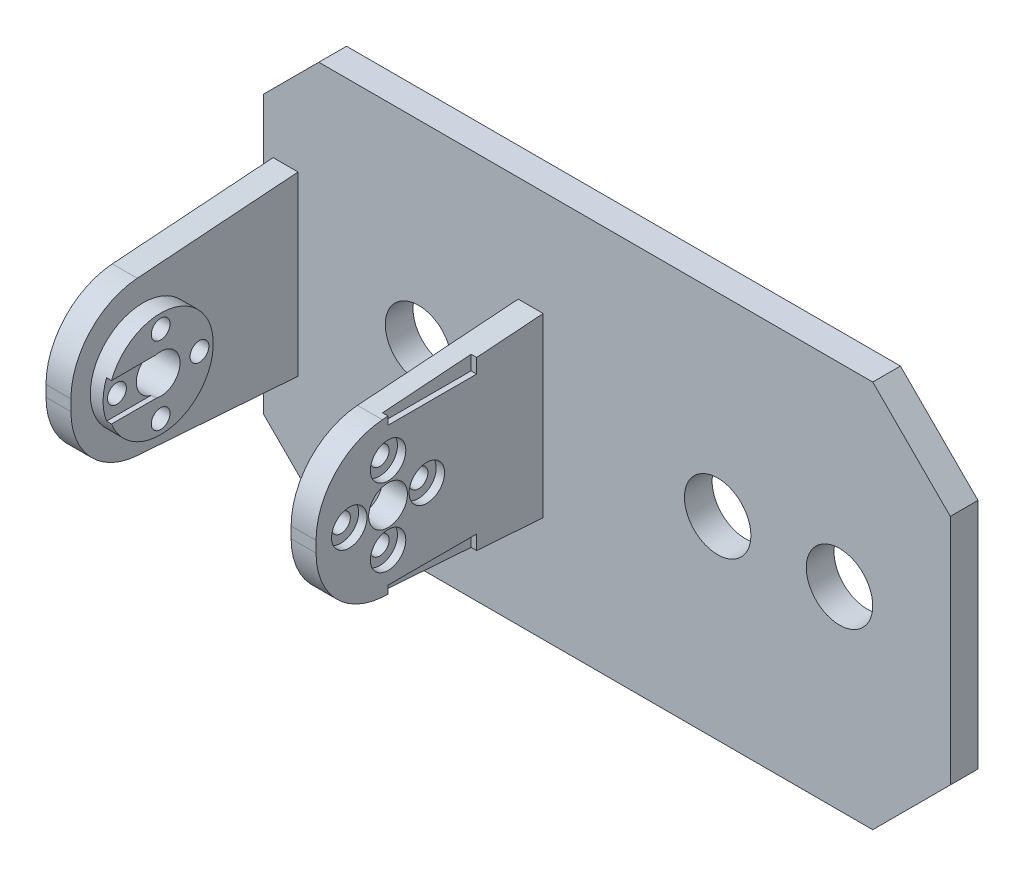
from build123d import *

# Parameters (mm, degrees)
BOSS_1_DEPTH    = 5
BOSS_2_DEPTH    = 4.5
S_CYL3_R        = 9.5
BOSS_3_DEPTH    = 3.2
BOSS_4_DEPTH    = 4.5
S_HOLE5_R       = 3.5
HOLE_5_DEPTH    = 4.7
S_HOLE6_R       = 1.7
HOLE_6_DEPTH    = 4.7
S_HOLE7_R       = 1.7
HOLE_7_DEPTH    = 4.7
S_HOLE8_R       = 1.7
HOLE_8_DEPTH    = 4.7
S_HOLE9_R       = 1.7
HOLE_9_DEPTH    = 4.7
S_HOLE10_R      = 3.2
HOLE_10_DEPTH   = 1.6
S_HOLE11_R      = 3.2
HOLE_11_DEPTH   = 1.6
S_HOLE12_R      = 3.2
HOLE_12_DEPTH   = 1.6
S_HOLE13_R      = 3.2
HOLE_13_DEPTH   = 1.6
S_HOLE14_R      = 3.5
HOLE_14_DEPTH   = 7.9
S_HOLE15_R      = 1.7
HOLE_15_DEPTH   = 7.9
S_HOLE16_R      = 1.7
HOLE_16_DEPTH   = 7.9
S_HOLE17_R      = 1.7
HOLE_17_DEPTH   = 7.9
S_HOLE18_R      = 1.7
HOLE_18_DEPTH   = 7.9
S_HOLE19_R      = 3.2
HOLE_19_DEPTH   = 2.1
S_HOLE20_R      = 3.2
HOLE_20_DEPTH   = 2.1
S_HOLE21_R      = 3.2
HOLE_21_DEPTH   = 2.1
S_HOLE22_R      = 3.2
HOLE_22_DEPTH   = 2.1
S_CUT23_W       = 1
S_CUT23_H       = 6.8
POCKET_23_DEPTH = 10
S_HOLE24_R      = 6
HOLE_24_DEPTH   = 5.2
S_HOLE25_R      = 6
HOLE_25_DEPTH   = 5.2
S_HOLE26_R      = 6
HOLE_26_DEPTH   = 5.2
S_CUT27_W       = 1.1
S_CUT27_H       = 4.5
POCKET_27_DEPTH = 16
S_CUT28_W       = 1.1
S_CUT28_H       = 4.5
POCKET_28_DEPTH = 16


with BuildPart() as part:
    # S_prism1 → Boss_1 (new body)
    with BuildSketch(Plane.XY.offset(-33)):
        Polygon((56, -21), (56, 21), (42, 35), (-58, 35), (-68, 25), (-68, -25), (-58, -35), (42, -35), align=None)
    extrude(amount=BOSS_1_DEPTH)

    # S_prism2 → Boss_2 (add)
    with BuildSketch(Plane(origin=(-22, 0, 0), x_dir=(0, 0, -1), z_dir=(1, 0, 0))):
        with BuildLine():
            Line((28.5, -16), (28.5, 16))
            Line((28.5, 16), (-1.0301, 13.8653))
            ThreePointArc((-1.0301, 13.8653), (-9.544808445, 9.785590923), (-13, 0.9989))
            Line((-13, 0.9989), (-13, -0.9989))
            ThreePointArc((-13, -0.9989), (-9.544808445, -9.785590923), (-1.0301, -13.8653))
            Line((-1.0301, -13.8653), (28.5, -16))
        make_face()
    extrude(amount=BOSS_2_DEPTH)



with BuildPart() as body_2:
    # S_cyl3 → Boss_3 (new body)
    with BuildSketch(Plane(origin=(-61.75, 0, 0), x_dir=(0, 0, -1), z_dir=(1, 0, 0))):
        Circle(S_CYL3_R)
    extrude(amount=BOSS_3_DEPTH)


with BuildPart() as part_1:
    add(part.part)

    add(body_2.part)  # Boss_4 merges body 2
    # S_prism4 → Boss_4 (add)
    with BuildSketch(Plane(origin=(-66.25, 0, 0), x_dir=(0, 0, -1), z_dir=(1, 0, 0))):
        with BuildLine():
            Line((28.5, -16), (28.5, 16))
            Line((28.5, 16), (-1.0301, 13.8653))
            ThreePointArc((-1.0301, 13.8653), (-9.544808445, 9.785590923), (-13, 0.9989))
            Line((-13, 0.9989), (-13, -0.9989))
            ThreePointArc((-13, -0.9989), (-9.544808445, -9.785590923), (-1.0301, -13.8653))
            Line((-1.0301, -13.8653), (28.5, -16))
        make_face()
    extrude(amount=BOSS_4_DEPTH)

    # S_hole5 → Hole_5 (cut)
    with BuildSketch(Plane(origin=(-22.1, 0, 0), x_dir=(0, 0, -1), z_dir=(1, 0, 0))):
        Circle(S_HOLE5_R)
    extrude(amount=HOLE_5_DEPTH, mode=Mode.SUBTRACT)

    # S_hole6 → Hole_6 (cut)
    with BuildSketch(Plane(origin=(-22.1, 0, 0), x_dir=(0, 0, -1), z_dir=(1, 0, 0))):
        with Locations((0, 7)):
            Circle(S_HOLE6_R)
    extrude(amount=HOLE_6_DEPTH, mode=Mode.SUBTRACT)

    # S_hole7 → Hole_7 (cut)
    with BuildSketch(Plane(origin=(-22.1, 0, 0), x_dir=(0, 0, -1), z_dir=(1, 0, 0))):
        with Locations((-7, 0)):
            Circle(S_HOLE7_R)
    extrude(amount=HOLE_7_DEPTH, mode=Mode.SUBTRACT)

    # S_hole8 → Hole_8 (cut)
    with BuildSketch(Plane(origin=(-22.1, 0, 0), x_dir=(0, 0, -1), z_dir=(1, 0, 0))):
        with Locations((0, -7)):
            Circle(S_HOLE8_R)
    extrude(amount=HOLE_8_DEPTH, mode=Mode.SUBTRACT)

    # S_hole9 → Hole_9 (cut)
    with BuildSketch(Plane(origin=(-22.1, 0, 0), x_dir=(0, 0, -1), z_dir=(1, 0, 0))):
        with Locations((7, 0)):
            Circle(S_HOLE9_R)
    extrude(amount=HOLE_9_DEPTH, mode=Mode.SUBTRACT)

    # S_hole10 → Hole_10 (cut)
    with BuildSketch(Plane(origin=(-19, 0, 0), x_dir=(0, 0, -1), z_dir=(1, 0, 0))):
        with Locations((0, 7)):
            Circle(S_HOLE10_R)
    extrude(amount=HOLE_10_DEPTH, mode=Mode.SUBTRACT)

    # S_hole11 → Hole_11 (cut)
    with BuildSketch(Plane(origin=(-19, 0, 0), x_dir=(0, 0, -1), z_dir=(1, 0, 0))):
        with Locations((-7, 0)):
            Circle(S_HOLE11_R)
    extrude(amount=HOLE_11_DEPTH, mode=Mode.SUBTRACT)

    # S_hole12 → Hole_12 (cut)
    with BuildSketch(Plane(origin=(-19, 0, 0), x_dir=(0, 0, -1), z_dir=(1, 0, 0))):
        with Locations((0, -7)):
            Circle(S_HOLE12_R)
    extrude(amount=HOLE_12_DEPTH, mode=Mode.SUBTRACT)

    # S_hole13 → Hole_13 (cut)
    with BuildSketch(Plane(origin=(-19, 0, 0), x_dir=(0, 0, -1), z_dir=(1, 0, 0))):
        with Locations((7, 0)):
            Circle(S_HOLE13_R)
    extrude(amount=HOLE_13_DEPTH, mode=Mode.SUBTRACT)

    # S_hole14 → Hole_14 (cut)
    with BuildSketch(Plane(origin=(-66.35, 0, 0), x_dir=(0, 0, -1), z_dir=(1, 0, 0))):
        Circle(S_HOLE14_R)
    extrude(amount=HOLE_14_DEPTH, mode=Mode.SUBTRACT)

    # S_hole15 → Hole_15 (cut)
    with BuildSketch(Plane(origin=(-66.35, 0, 0), x_dir=(0, 0, -1), z_dir=(1, 0, 0))):
        with Locations((0, 7)):
            Circle(S_HOLE15_R)
    extrude(amount=HOLE_15_DEPTH, mode=Mode.SUBTRACT)

    # S_hole16 → Hole_16 (cut)
    with BuildSketch(Plane(origin=(-66.35, 0, 0), x_dir=(0, 0, -1), z_dir=(1, 0, 0))):
        with Locations((-7, 0)):
            Circle(S_HOLE16_R)
    extrude(amount=HOLE_16_DEPTH, mode=Mode.SUBTRACT)

    # S_hole17 → Hole_17 (cut)
    with BuildSketch(Plane(origin=(-66.35, 0, 0), x_dir=(0, 0, -1), z_dir=(1, 0, 0))):
        with Locations((0, -7)):
            Circle(S_HOLE17_R)
    extrude(amount=HOLE_17_DEPTH, mode=Mode.SUBTRACT)

    # S_hole18 → Hole_18 (cut)
    with BuildSketch(Plane(origin=(-66.35, 0, 0), x_dir=(0, 0, -1), z_dir=(1, 0, 0))):
        with Locations((7, 0)):
            Circle(S_HOLE18_R)
    extrude(amount=HOLE_18_DEPTH, mode=Mode.SUBTRACT)

    # S_hole19 → Hole_19 (cut)
    with BuildSketch(Plane(origin=(-66.35, 0, 0), x_dir=(0, 0, -1), z_dir=(1, 0, 0))):
        with Locations((0, 7)):
            Circle(S_HOLE19_R)
    extrude(amount=HOLE_19_DEPTH, mode=Mode.SUBTRACT)

    # S_hole20 → Hole_20 (cut)
    with BuildSketch(Plane(origin=(-66.35, 0, 0), x_dir=(0, 0, -1), z_dir=(1, 0, 0))):
        with Locations((-7, 0)):
            Circle(S_HOLE20_R)
    extrude(amount=HOLE_20_DEPTH, mode=Mode.SUBTRACT)

    # S_hole21 → Hole_21 (cut)
    with BuildSketch(Plane(origin=(-66.35, 0, 0), x_dir=(0, 0, -1), z_dir=(1, 0, 0))):
        with Locations((0, -7)):
            Circle(S_HOLE21_R)
    extrude(amount=HOLE_21_DEPTH, mode=Mode.SUBTRACT)

    # S_hole22 → Hole_22 (cut)
    with BuildSketch(Plane(origin=(-66.35, 0, 0), x_dir=(0, 0, -1), z_dir=(1, 0, 0))):
        with Locations((7, 0)):
            Circle(S_HOLE22_R)
    extrude(amount=HOLE_22_DEPTH, mode=Mode.SUBTRACT)

    # S_cut23 → Pocket_23 (cut)
    with BuildSketch(Plane.XY):
        with Locations((-58.95, 0)):
            Rectangle(S_CUT23_W, S_CUT23_H)
    extrude(amount=POCKET_23_DEPTH, mode=Mode.SUBTRACT)

    # S_hole24 → Hole_24 (cut)
    with BuildSketch(Plane.XY.offset(-33.1)):
        with Locations((-40, 0)):
            Circle(S_HOLE24_R)
    extrude(amount=HOLE_24_DEPTH, mode=Mode.SUBTRACT)

    # S_hole25 → Hole_25 (cut)
    with BuildSketch(Plane.XY.offset(-33.1)):
        with Locations((14, 0)):
            Circle(S_HOLE25_R)
    extrude(amount=HOLE_25_DEPTH, mode=Mode.SUBTRACT)

    # S_hole26 → Hole_26 (cut)
    with BuildSketch(Plane.XY.offset(-33.1)):
        with Locations((36, 0)):
            Circle(S_HOLE26_R)
    extrude(amount=HOLE_26_DEPTH, mode=Mode.SUBTRACT)

    # S_cut27 → Pocket_27 (cut)
    with BuildSketch(Plane.XY.offset(-16)):
        with Locations((-17.95, 14.75)):
            Rectangle(S_CUT27_W, S_CUT27_H)
    extrude(amount=POCKET_27_DEPTH, mode=Mode.SUBTRACT)

    # S_cut28 → Pocket_28 (cut)
    with BuildSketch(Plane.XY.offset(-16)):
        with Locations((-17.95, -14.75)):
            Rectangle(S_CUT28_W, S_CUT28_H)
    extrude(amount=POCKET_28_DEPTH, mode=Mode.SUBTRACT)


solid = part_1.part
